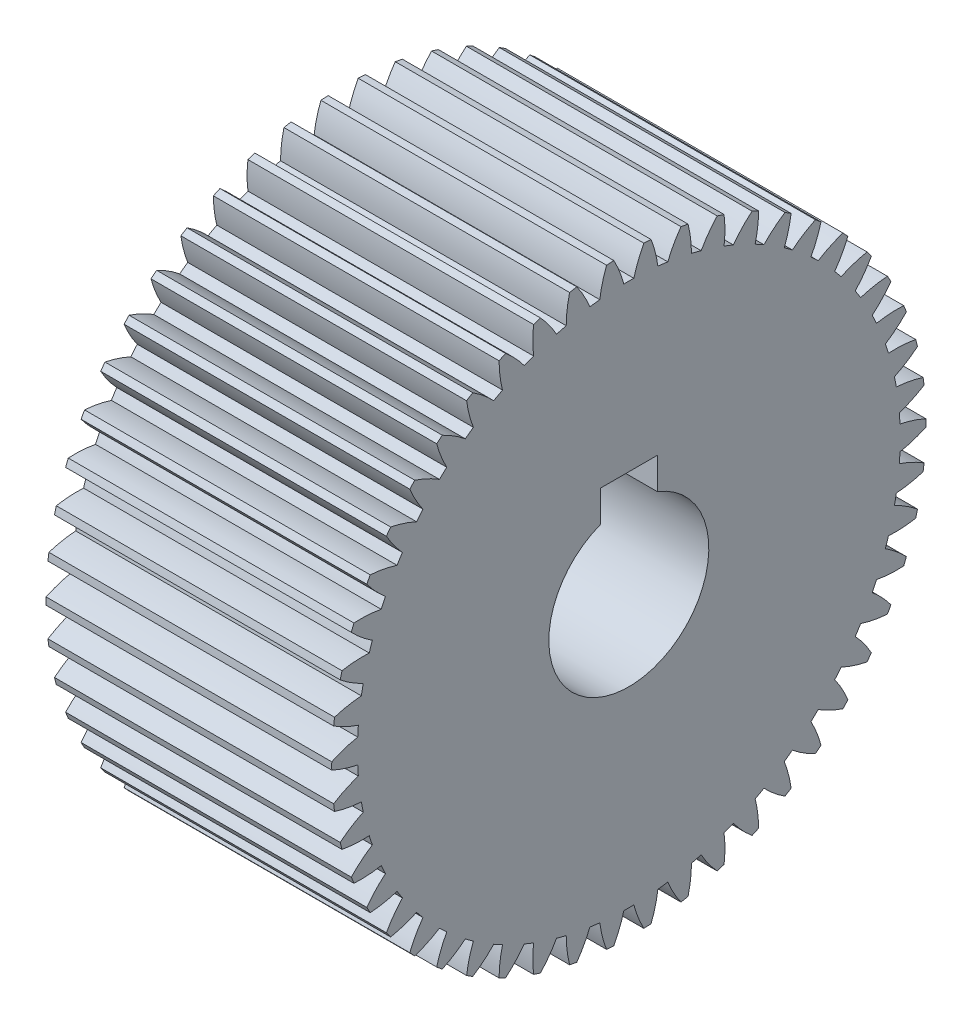
from build123d import *

# Parameters (mm, degrees)
BASPROSKE_W     = 25
BASPROSKE_H     = 26
TOOTHCUT_DEPTH  = 45.463468151
TEETHCUTS_COUNT = 50
TEETHCUTS_ANGLE = 352.8
BORSKE_R        = 7
BORE_DEPTH      = 50.0000508
KEYSKE_W        = 5
KEYSKE_H        = 9.3
KEYWAY_DEPTH    = 50.0000508


with BuildPart() as part:
    # BasProSke → Base-Revolve (revolve)
    with BuildSketch(Plane(origin=(0, 0, 0), x_dir=(1, 0, 0), z_dir=(0, 1, 0)), mode=Mode.PRIVATE) as base_revolve_sk:
        with Locations((12.5, 13)):
            Rectangle(BASPROSKE_W, BASPROSKE_H)
    revolve(base_revolve_sk.sketch.rotate(Axis((-10, 0, 0), (1, 0, 0)), 180), axis=Axis((-10, 0, 0), (1, 0, 0)))

    # TooCutSke → ToothCut (cut, through all)
    with BuildSketch(Plane(origin=(0, 0, 0), x_dir=(0, 0, -1), z_dir=(1, 0, 0))):
        with BuildLine():
            ThreePointArc((0.437663408, 23.744966872), (0, 23.749), (-0.437663408, 23.744966872))
            ThreePointArc((-0.437663408, 23.744966872), (-0.815428123, 24.895236298), (-1.329433358, 25.991422664))
            ThreePointArc((-1.329433358, 25.991422664), (0, 26.0254), (1.329433358, 25.991422664))
            ThreePointArc((1.329433358, 25.991422664), (0.815428123, 24.895236298), (0.437663408, 23.744966872))
        make_face()
    toothcut = extrude(amount=TOOTHCUT_DEPTH, mode=Mode.SUBTRACT)

    # TeethCuts: ToothCut ×50 about axis
    teethcuts_axis = Axis((-10, 0, 0), (1, 0, 0))
    for i in range(1, TEETHCUTS_COUNT):
        add(toothcut.rotate(teethcuts_axis, i * TEETHCUTS_ANGLE / (TEETHCUTS_COUNT - 1)), mode=Mode.SUBTRACT)

    # BorSke → Bore (cut, symmetric)
    with BuildSketch(Plane(origin=(0, 0, 0), x_dir=(0, 0, -1), z_dir=(1, 0, 0))):
        with Locations(Location((0, 0, 0), (0, 0, 180))):
            Circle(BORSKE_R)
    extrude(amount=BORE_DEPTH, both=True, mode=Mode.SUBTRACT)

    # KeySke → Keyway (cut, symmetric)
    with BuildSketch(Plane(origin=(0, 0, 0), x_dir=(0, 0, -1), z_dir=(1, 0, 0))):
        with Locations((0, 4.65)):
            Rectangle(KEYSKE_W, KEYSKE_H)
    extrude(amount=KEYWAY_DEPTH, both=True, mode=Mode.SUBTRACT)


solid = part.part
